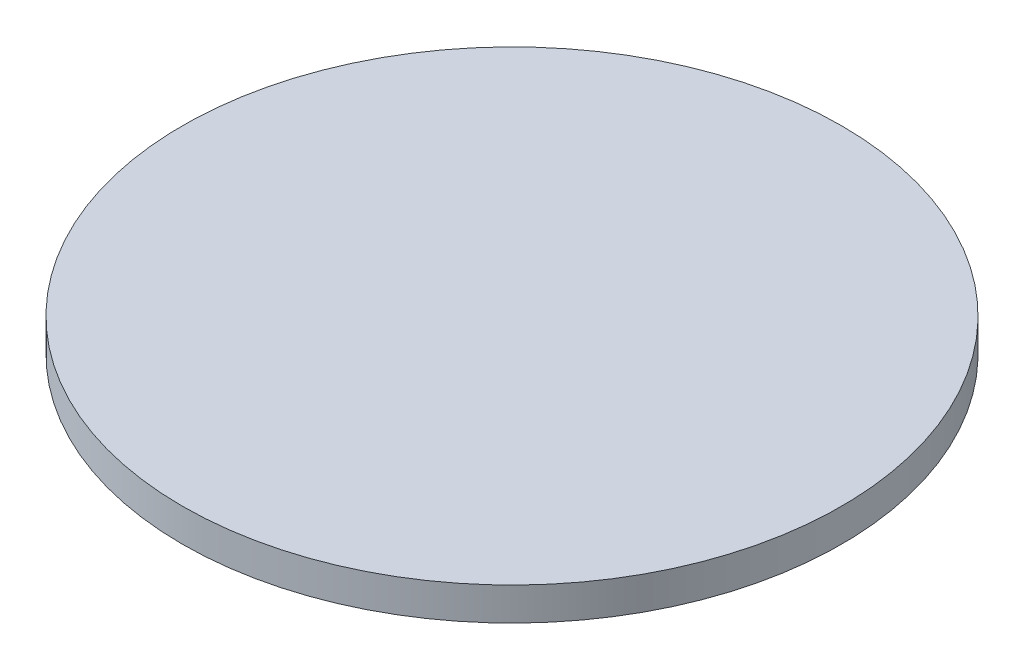
from build123d import *

# Parameters (mm, degrees)
ESQUISSE1_R        = 25
BOSS_EXTRU_1_DEPTH = 6
CHANFREIN1_SIZE    = 6
CHANFREIN1_SIZE2   = 3.5


with BuildPart() as part:
    # Esquisse1 → Boss.-Extru.1 (new body)
    with BuildSketch(Plane(origin=(0, 0, 0), x_dir=(1, 0, 0), z_dir=(0, 1, 0))):
        with Locations(Location((-5.779650328, 0, 0), (0, 0, 270))):
            Circle(ESQUISSE1_R)
    extrude(amount=BOSS_EXTRU_1_DEPTH)

    # Chanfrein1
    chanfrein1_edges = [part.edges().sort_by_distance(p)[0] for p in [
        (-5.779650328, 0, -25),
    ]]
    chanfrein1_side = [part.faces().sort_by_distance(p)[0] for p in [
        (-5.779650328, 0, 0),
    ]]
    chamfer(chanfrein1_edges, length=CHANFREIN1_SIZE, length2=CHANFREIN1_SIZE2, reference=chanfrein1_side[0])


solid = part.part
